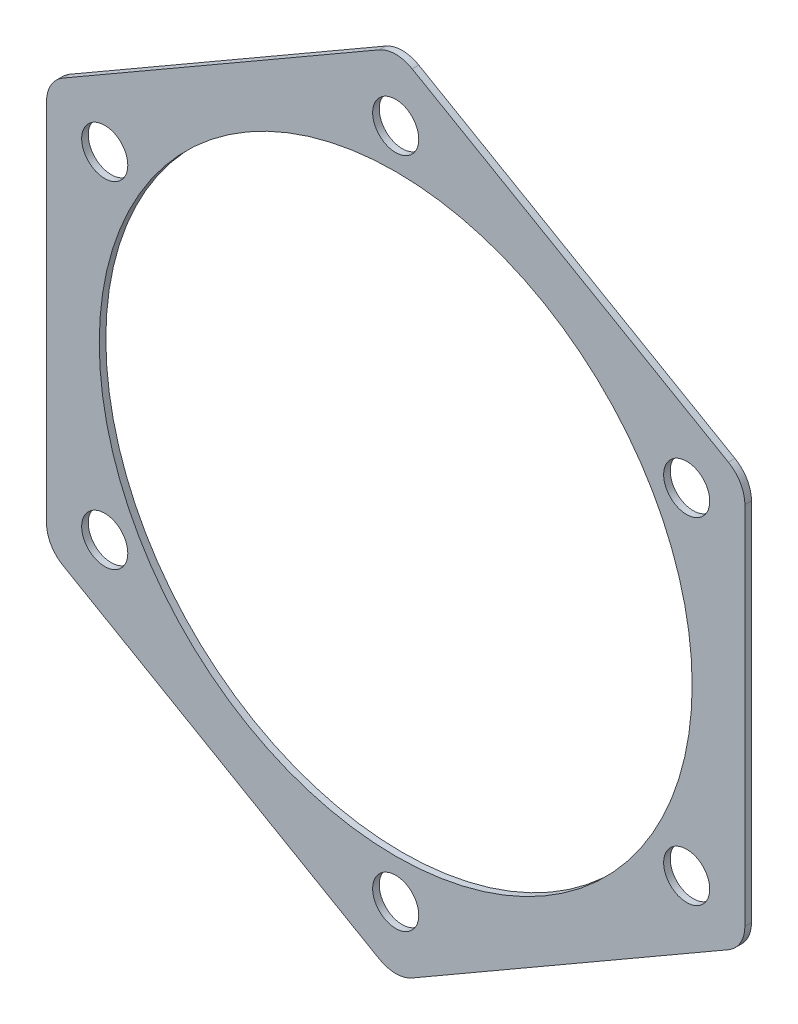
from build123d import *

# Parameters (mm, degrees)
SKETCH1_R           = 45
SKETCH1_R_2         = 3.5
BOSS_EXTRUDE1_DEPTH = 1
FILLET1_R           = 5


with BuildPart() as part:
    # Sketch1 → Boss-Extrude1 (new body)
    with BuildSketch(Plane.XY):
        Polygon((0, 61.199128534), (-53, 30.599564267), (-53, -30.599564267), (0, -61.199128534), (53, -30.599564267), (53, 30.599564267), align=None)
        Circle(SKETCH1_R, mode=Mode.SUBTRACT)
        with Locations((0, 51)):
            Circle(SKETCH1_R_2, mode=Mode.SUBTRACT)
        with Locations((44.167295593, 25.5)):
            Circle(SKETCH1_R_2, mode=Mode.SUBTRACT)
        with Locations((44.167295593, -25.5)):
            Circle(SKETCH1_R_2, mode=Mode.SUBTRACT)
        with Locations((0, -51)):
            Circle(SKETCH1_R_2, mode=Mode.SUBTRACT)
        with Locations((-44.167295593, -25.5)):
            Circle(SKETCH1_R_2, mode=Mode.SUBTRACT)
        with Locations((-44.167295593, 25.5)):
            Circle(SKETCH1_R_2, mode=Mode.SUBTRACT)
    extrude(amount=BOSS_EXTRUDE1_DEPTH)

    # Fillet1
    fillet1_edges = [part.edges().sort_by_distance(p)[0] for p in [
        (53, 30.599564267, 0.5),
        (53, -30.599564267, 0.5),
        (0, -61.199128534, 0.5),
        (-53, -30.599564267, 0.5),
        (-53, 30.599564267, 0.5),
        (0, 61.199128534, 0.5),
    ]]
    fillet(fillet1_edges, radius=FILLET1_R)


solid = part.part
